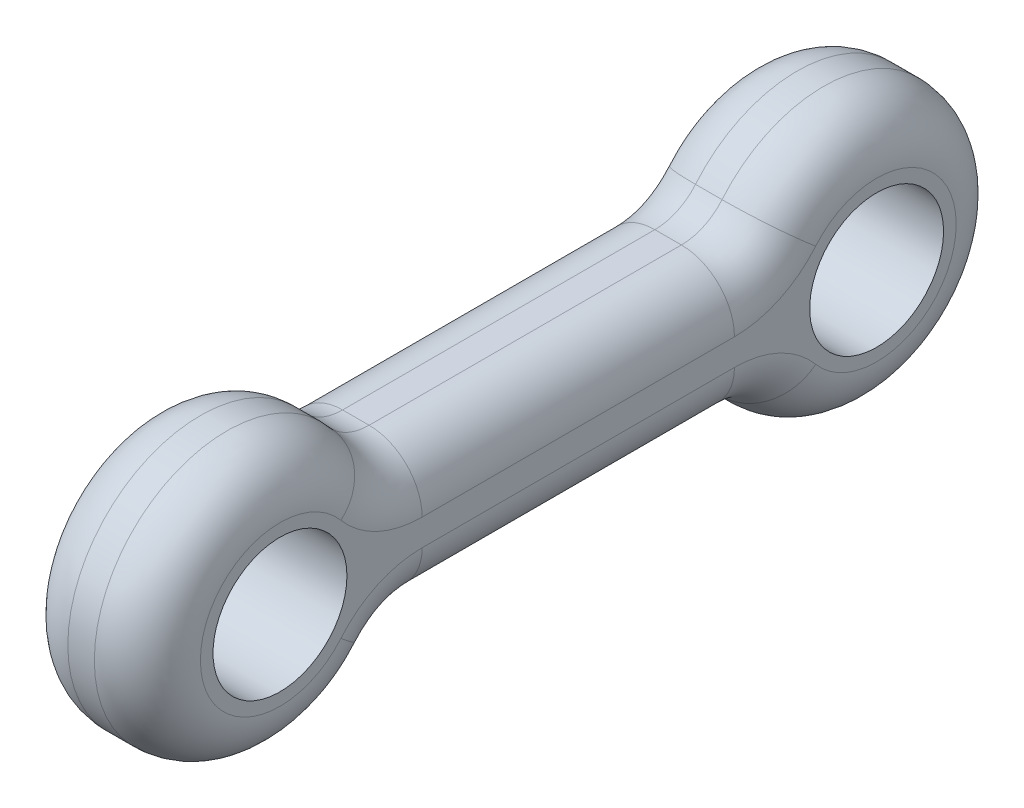
from build123d import *

# Parameters (mm, degrees)
BOSS_EXTRUDE2_DEPTH = 20
SKETCH4_R           = 10.1
CUT_EXTRUDE1_DEPTH  = 20
SKETCH5_R           = 10.1
CUT_EXTRUDE2_DEPTH  = 20
FILLET1_R           = 8
SCALE1_SCALE        = 0.5


with BuildPart() as part:
    # Sketch3 → Boss-Extrude2 (new body)
    with BuildSketch(Plane(origin=(0, 0, 0), x_dir=(0, 0, -1), z_dir=(1, 0, 0))):
        with BuildLine():
            Line((-17.320508076, -10), (-72.679491924, -10))
            ThreePointArc((-72.679491924, -10), (-110, 0), (-72.679491924, 10))
            Line((-72.679491924, 10), (-17.320508076, 10))
            ThreePointArc((-17.320508076, 10), (20, 0), (-17.320508076, -10))
        make_face()
    extrude(amount=BOSS_EXTRUDE2_DEPTH)

    # Sketch4 → Cut-Extrude1 (cut)
    with BuildSketch(Plane(origin=(0, 0, 0), x_dir=(0, 0, -1), z_dir=(1, 0, 0))):
        with Locations((-90, 0)):
            Circle(SKETCH4_R)
    extrude(amount=CUT_EXTRUDE1_DEPTH, mode=Mode.SUBTRACT)

    # Sketch5 → Cut-Extrude2 (cut)
    with BuildSketch(Plane(origin=(0, 0, 0), x_dir=(0, 0, -1), z_dir=(1, 0, 0))):
        Circle(SKETCH5_R)
    extrude(amount=CUT_EXTRUDE2_DEPTH, mode=Mode.SUBTRACT)

    # Fillet1
    fillet1_edges = [part.edges().sort_by_distance(p)[0] for p in [
        (20, 0, 110),
        (20, -10, 45),
        (20, 0, -20),
        (0, -10, 45),
        (0, 0, 110),
        (0, 10, 45),
        (0, 0, -20),
        (10, -10, 17.320508076),
        (10, -10, 72.679491924),
        (10, 10, 72.679491924),
        (10, 10, 17.320508076),
        (20, 10, 45),
    ]]
    fillet(fillet1_edges, radius=FILLET1_R)


with BuildPart() as part_1:
    # Scale1: scaled about (0, 0, 0)
    add(part.part.scale(SCALE1_SCALE))


solid = part_1.part
